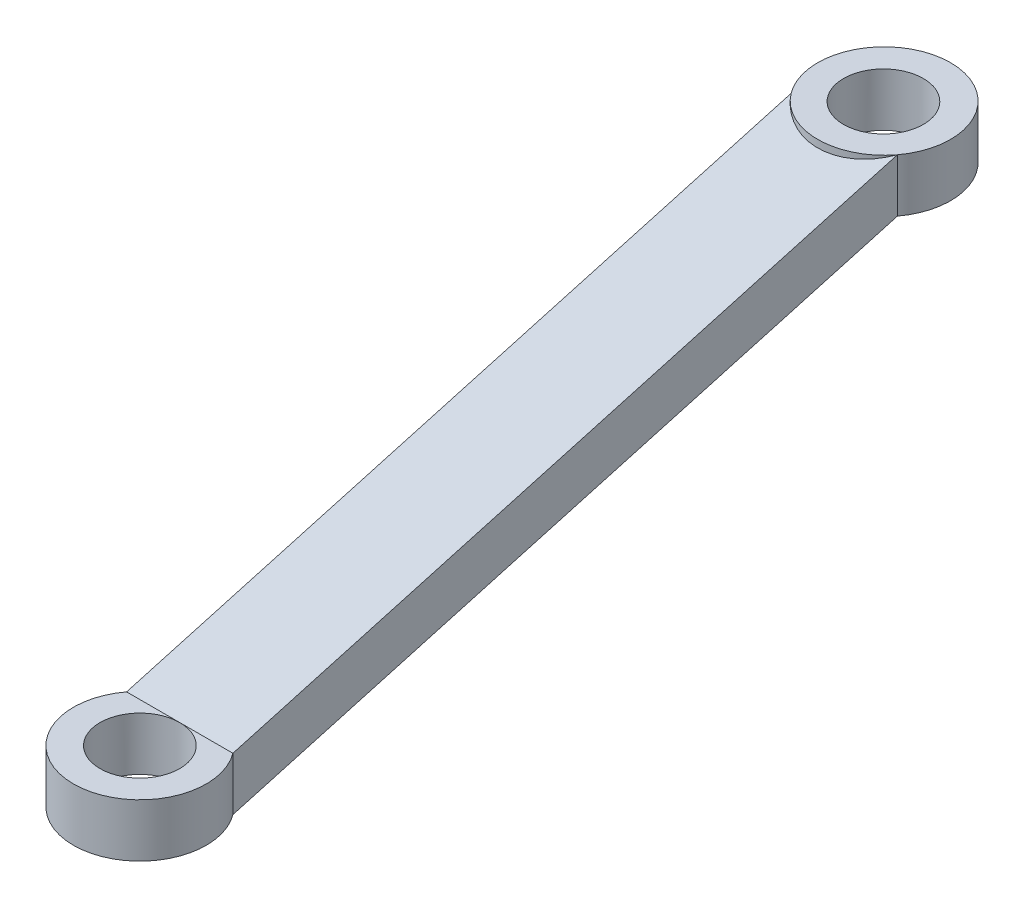
from build123d import *

# Parameters (mm, degrees)
BOSS_EXTRUDE1_DEPTH = 4
SKETCH2_R           = 2.5
BOSS_EXTRUDE2_DEPTH = 2
SKETCH3_R           = 2.5
BOSS_EXTRUDE3_DEPTH = 2
SKETCH4_R           = 1.5
CUT_EXTRUDE1_DEPTH  = 31.170349683
SKETCH5_R           = 1.5
CUT_EXTRUDE2_DEPTH  = 31.696090956


with BuildPart() as part:
    # Sketch1 → Boss-Extrude1 (new body)
    with BuildSketch(Plane(origin=(0, 0, 0), x_dir=(0, 0, -1), z_dir=(1, 0, 0))):
        Polygon((0, 0), (0, 2), (25, 9), (25, 7), align=None)
    extrude(amount=BOSS_EXTRUDE1_DEPTH)

    # Sketch2 → Boss-Extrude2 (add)
    with BuildSketch(Plane(origin=(0, 0, 0), x_dir=(1, 0, 0), z_dir=(0, 1, 0))):
        with Locations((2, -1.5)):
            Circle(SKETCH2_R)
    extrude(amount=BOSS_EXTRUDE2_DEPTH)

    # Sketch3 → Boss-Extrude3 (add)
    with BuildSketch(Plane(origin=(0, 7, 0), x_dir=(-1, 0, 0), z_dir=(0, -1, 0))):
        with Locations((-2, 26.5)):
            Circle(SKETCH3_R)
    extrude(amount=-BOSS_EXTRUDE3_DEPTH)

    # Sketch4 → Cut-Extrude1 (cut, through all)
    with BuildSketch(Plane(origin=(0, 2, 0), x_dir=(1, 0, 0), z_dir=(0, 1, 0))):
        with Locations(Location((2, -1.5, 0), (0, 0, 270))):
            Circle(SKETCH4_R)
    extrude(amount=-CUT_EXTRUDE1_DEPTH, mode=Mode.SUBTRACT)

    # Sketch5 → Cut-Extrude2 (cut, through all)
    with BuildSketch(Plane(origin=(0, 9, 0), x_dir=(1, 0, 0), z_dir=(0, 1, 0))):
        with Locations(Location((2.001528026, 26.473342357, 0), (0, 0, 270))):
            Circle(SKETCH5_R)
    extrude(amount=-CUT_EXTRUDE2_DEPTH, mode=Mode.SUBTRACT)


solid = part.part
